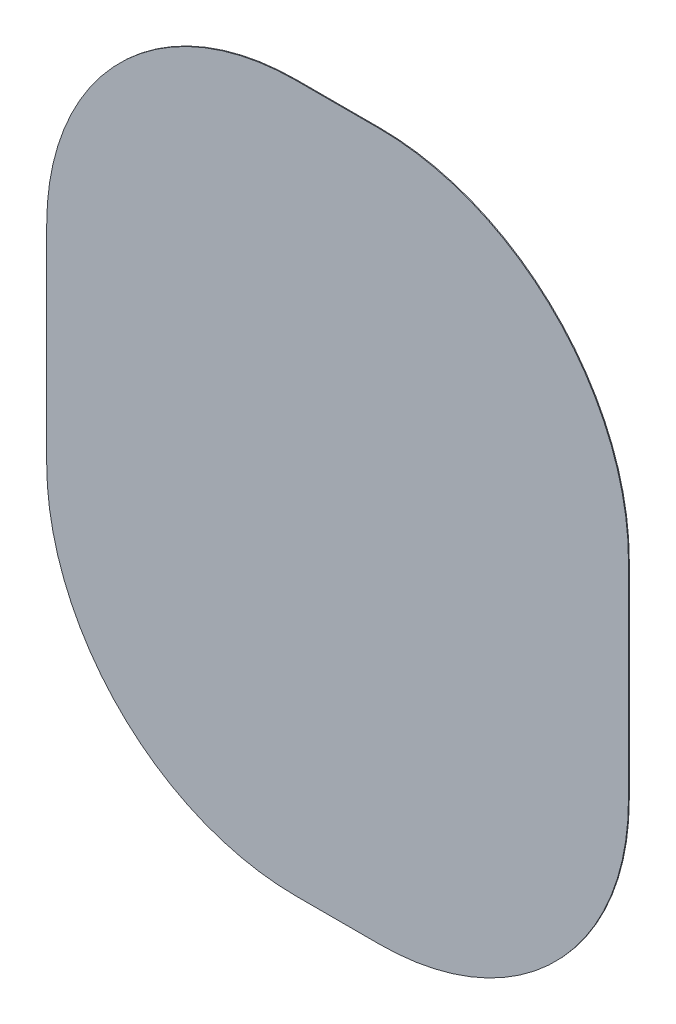
from build123d import *

# Parameters (mm, degrees)
BOSS_EXTRUDE1_DEPTH = 0.1


with BuildPart() as part:
    # Sketch1 → Boss-Extrude1 (new body)
    with BuildSketch(Plane.XY):
        with BuildLine():
            Line((5, -42.5), (-5, -42.5))
            ThreePointArc((-5, -42.5), (-26.213203436, -33.713203436), (-35, -12.5))
            Line((-35, -12.5), (-35, 12.5))
            ThreePointArc((-35, 12.5), (-26.213203436, 33.713203436), (-5, 42.5))
            Line((-5, 42.5), (5, 42.5))
            ThreePointArc((5, 42.5), (26.213203436, 33.713203436), (35, 12.5))
            Line((35, 12.5), (35, -12.5))
            ThreePointArc((35, -12.5), (26.213203436, -33.713203436), (5, -42.5))
        make_face()
    extrude(amount=BOSS_EXTRUDE1_DEPTH)


solid = part.part
